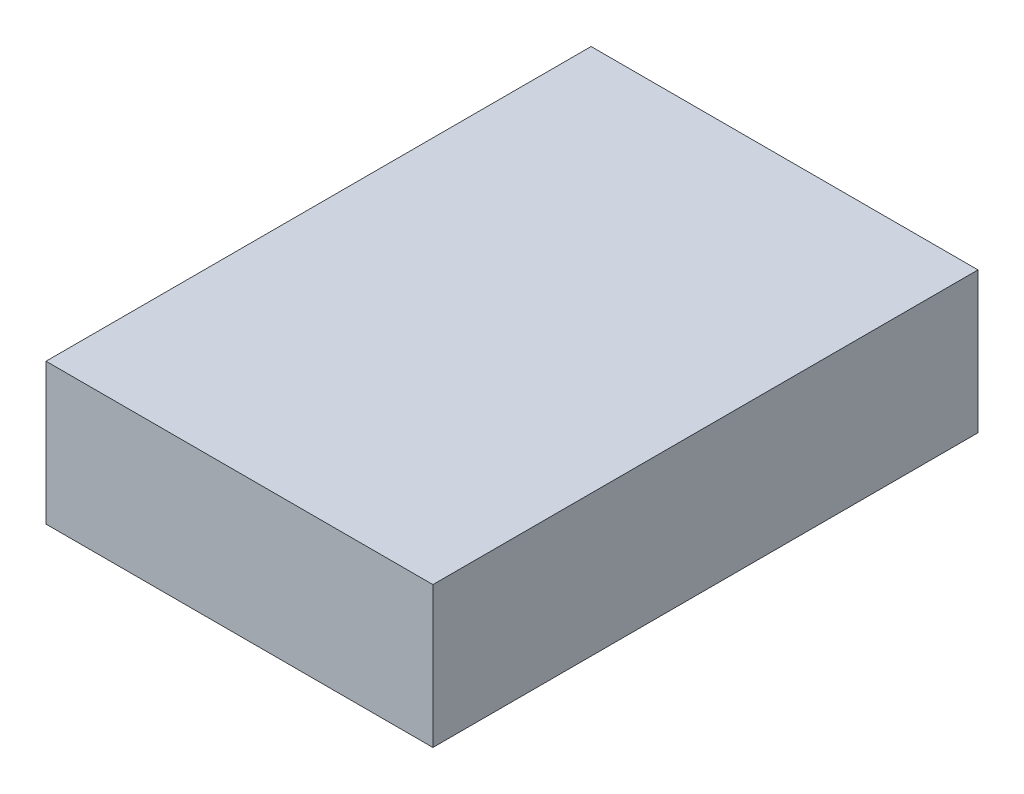
from build123d import *

# Parameters (mm, degrees)
SKETCH1_W           = 45.974
SKETCH1_H           = 16.764
BOSS_EXTRUDE1_DEPTH = 64.77


with BuildPart() as part:
    # Sketch1 → Boss-Extrude1 (new body)
    with BuildSketch(Plane.XY):
        with Locations((22.987, 8.382)):
            Rectangle(SKETCH1_W, SKETCH1_H)
    extrude(amount=BOSS_EXTRUDE1_DEPTH)


solid = part.part
